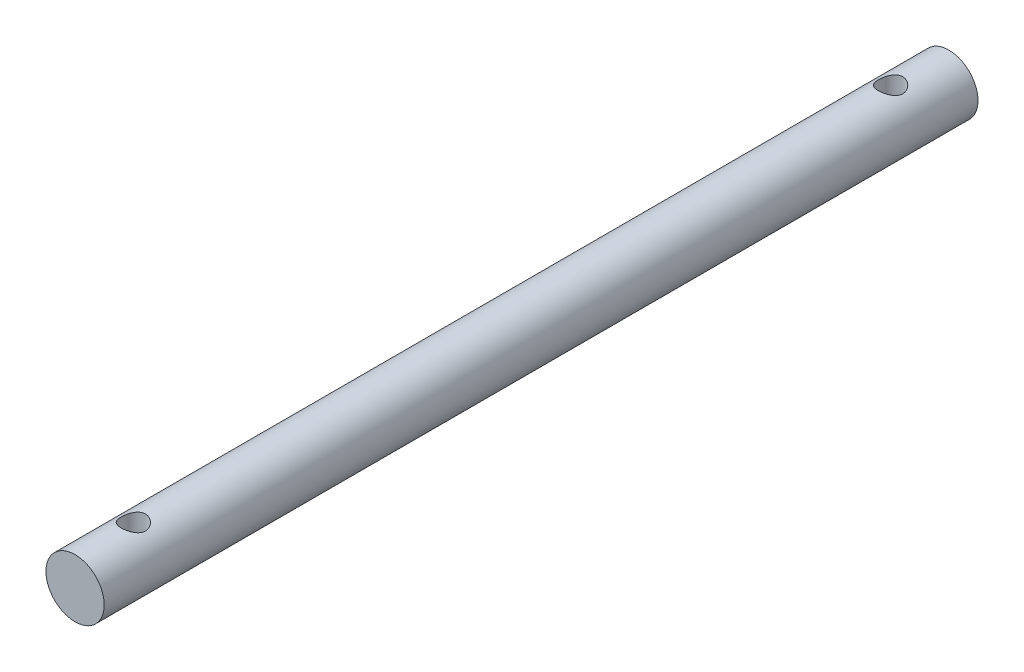
from build123d import *

# Parameters (mm, degrees)
SKETCH1_R               = 5
BOSS_EXTRUDE1_DEPTH     = 75
CUT_EXTRUDE1_DEPTH      = 76.332595867
CUT_EXTRUDE1_DEPTH_BACK = 76.332595867
SKETCH2_R               = 2.0828


with BuildPart() as part:
    # Sketch1 → Boss-Extrude1 (new, symmetric)
    with BuildSketch(Plane.XY):
        Circle(SKETCH1_R)
    extrude(amount=BOSS_EXTRUDE1_DEPTH, both=True)

    # Sketch2 → Cut-Extrude1 (cut, two sides: drawn at the far end of the back side and taken through both)
    with BuildSketch(Plane(origin=(0, 0, 0), x_dir=(1, 0, 0), z_dir=(0, 1, 0)).offset(-CUT_EXTRUDE1_DEPTH_BACK)):
        with Locations(Location((0, 65, 0), (0, 0, 270))):
            Circle(SKETCH2_R)
        with Locations(Location((0, -65, 0), (0, 0, 270))):
            Circle(SKETCH2_R)
    extrude(amount=CUT_EXTRUDE1_DEPTH + CUT_EXTRUDE1_DEPTH_BACK, mode=Mode.SUBTRACT)


solid = part.part
